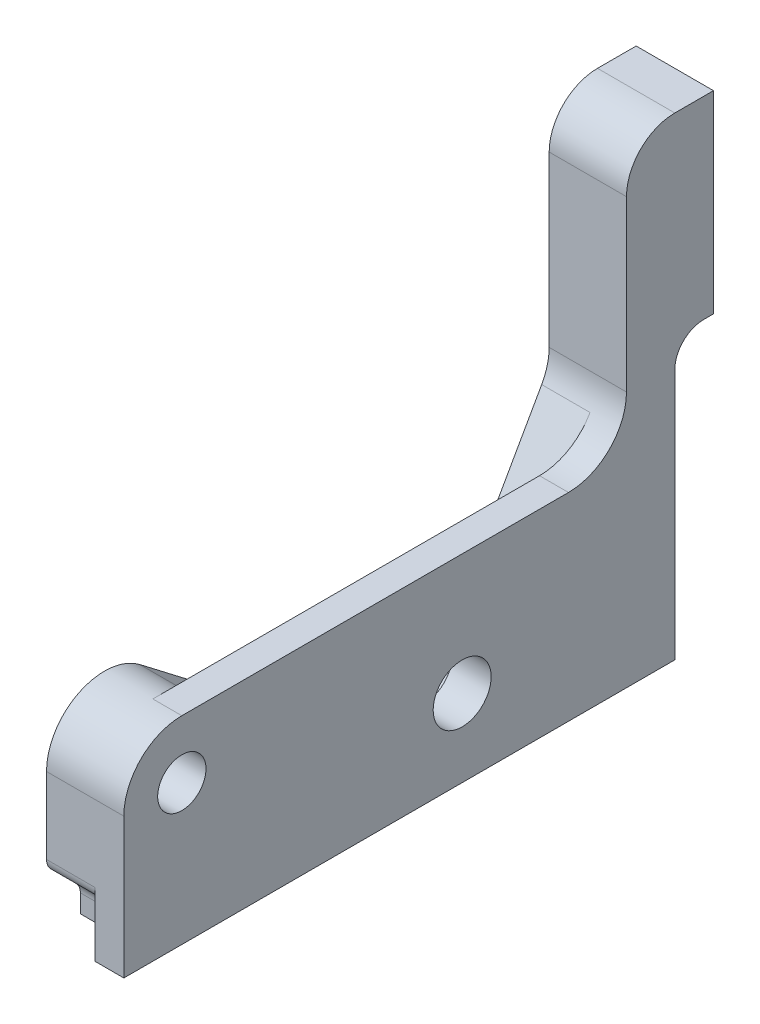
from build123d import *

# Parameters (mm, degrees)
SKETCH1_W                   = 61
SKETCH1_H                   = 49
SKETCH1_R                   = 2.5
SKETCH1_R_2                 = 3
BOSS_EXTRUDE1_DEPTH         = 8
CUT_EXTRUDE1_REACH          = 80.651
CUT_EXTRUDE2_REACH          = 80.651
SKETCH3_W                   = 4
SKETCH3_H                   = 29
FILLET1_R                   = 5
FILLET2_R                   = 3
TAP_DRILL_FOR_M3_TAP1_D     = 2.5
TAP_DRILL_FOR_M3_TAP1_DEPTH = 10
TAP_DRILL_FOR_M3_TAP1_TIP   = 0.751075774
TAP_DRILL_FOR_M3_TAP2_D     = 2.5
TAP_DRILL_FOR_M3_TAP2_DEPTH = 8
TAP_DRILL_FOR_M3_TAP2_TIP   = 0.751075774
CUT_EXTRUDE3_START          = -5
CUT_EXTRUDE3_DEPTH          = 5
SKETCH10_R                  = 3
BOSS_EXTRUDE2_DEPTH         = 1
FILLET3_R                   = 1.5


with BuildPart() as part:
    # Sketch1 → Boss-Extrude1 (new body)
    with BuildSketch(Plane(origin=(0, 0, 0), x_dir=(0, 0, -1), z_dir=(1, 0, 0))):
        with Locations((30.5, 24.5)):
            Rectangle(SKETCH1_W, SKETCH1_H)
        with Locations((6, 14.5)):
            Circle(SKETCH1_R, mode=Mode.SUBTRACT)
        with Locations((35, 8)):
            Circle(SKETCH1_R_2, mode=Mode.SUBTRACT)
    extrude(amount=BOSS_EXTRUDE1_DEPTH)

    # Sketch2 → Cut-Extrude1 (cut, up to next)
    with BuildSketch(Plane(origin=(8, 0, 0), x_dir=(0, 0, -1), z_dir=(1, 0, 0)), mode=Mode.PRIVATE) as cut_extrude1_sk1:
        with BuildLine():
            Line((6, 20.5), (46, 20.5))
            ThreePointArc((46, 20.5), (50.242640687, 22.257359313), (52, 26.5))
            Line((52, 26.5), (52, 50))
            Line((52, 50), (0, 50))
            Line((0, 50), (0, 14.5))
            ThreePointArc((0, 14.5), (1.757359313, 18.742640687), (6, 20.5))
        make_face()
    cut_extrude1_tool1 = extrude(cut_extrude1_sk1.sketch, amount=-CUT_EXTRUDE1_REACH, mode=Mode.PRIVATE) & part.part
    add(cut_extrude1_tool1.solids().sort_by_distance((8, 35.236501, -25.751612))[0], mode=Mode.SUBTRACT)

    # Sketch3 → Cut-Extrude2 (cut, up to next)
    with BuildSketch(Plane(origin=(8, 0, 0), x_dir=(0, 0, -1), z_dir=(1, 0, 0)), mode=Mode.PRIVATE) as cut_extrude2_sk1:
        with Locations((59, 14.5)):
            Rectangle(SKETCH3_W, SKETCH3_H)
    cut_extrude2_tool1 = extrude(cut_extrude2_sk1.sketch, amount=-CUT_EXTRUDE2_REACH, mode=Mode.PRIVATE) & part.part
    add(cut_extrude2_tool1.solids().sort_by_distance((8, 14.5, -59))[0], mode=Mode.SUBTRACT)

    # Fillet1
    fillet1_edges = [part.edges().sort_by_distance(p)[0] for p in [
        (4, 49, -52),
    ]]
    fillet(fillet1_edges, radius=FILLET1_R)

    # Fillet2
    fillet2_edges = [part.edges().sort_by_distance(p)[0] for p in [
        (4, 29, -57),
    ]]
    fillet(fillet2_edges, radius=FILLET2_R)

    # Tap Drill for M3 Tap1
    with Locations(Plane(origin=(0, 0, 0), x_dir=(-1, 0, 0), z_dir=(0, -1, 0))):
        with Locations((-4, 48), (-4, 12)):
            Hole(TAP_DRILL_FOR_M3_TAP1_D / 2, depth=TAP_DRILL_FOR_M3_TAP1_DEPTH)
            with Locations((0, 0, -(TAP_DRILL_FOR_M3_TAP1_DEPTH + TAP_DRILL_FOR_M3_TAP1_TIP / 2))):  # 118° drill point
                Cone(0, TAP_DRILL_FOR_M3_TAP1_D / 2, TAP_DRILL_FOR_M3_TAP1_TIP, mode=Mode.SUBTRACT)

    # Tap Drill for M3 Tap2
    with Locations(Plane(origin=(0, 0, -61), x_dir=(-1, 0, 0), z_dir=(0, 0, -1))):
        with Locations((-4, 44), (-4, 34)):
            Hole(TAP_DRILL_FOR_M3_TAP2_D / 2, depth=TAP_DRILL_FOR_M3_TAP2_DEPTH)
            with Locations((0, 0, -(TAP_DRILL_FOR_M3_TAP2_DEPTH + TAP_DRILL_FOR_M3_TAP2_TIP / 2))):  # 118° drill point
                Cone(0, TAP_DRILL_FOR_M3_TAP2_D / 2, TAP_DRILL_FOR_M3_TAP2_TIP, mode=Mode.SUBTRACT)

    # Sketch9 → Cut-Extrude3 (cut)
    with BuildSketch(Plane.ZY.offset(CUT_EXTRUDE3_START)):
        with BuildLine():
            Line((-51.227059389, 23.554180904), (-40.662647671, 4.808695979))
            ThreePointArc((-40.662647671, 4.808695979), (-36.300887291, 1.631507851), (-31.042531435, 2.843601785))
            Line((-31.042531435, 2.843601785), (-9.653047907, 19.259752199))
            ThreePointArc((-9.653047907, 19.259752199), (-3.346538811, 19.88137006), (0, 14.5))
            Line((0, 14.5), (0, 26.5))
            Line((0, 26.5), (-52, 26.5))
            ThreePointArc((-52, 26.5), (-51.803548756, 24.97723218), (-51.227059389, 23.554180904))
        make_face()
        Polygon((0, 6), (-3.5, 2.5), (-3.5, 0), (0, 0), align=None)
    extrude(amount=CUT_EXTRUDE3_DEPTH, mode=Mode.SUBTRACT)

    # Sketch10 → Boss-Extrude2 (add)
    with BuildSketch(Plane.ZY.offset(-5)):
        with BuildLine():
            Line((-42.701798604, 8.426964), (-40.662647671, 4.808695979))
            ThreePointArc((-40.662647671, 4.808695979), (-36.300887291, 1.631507851), (-31.042531435, 2.843601785))
            Line((-31.042531435, 2.843601785), (-27.747742168, 5.372309694))
            ThreePointArc((-27.747742168, 5.372309694), (-29.469968742, 5.299086519), (-30.123849342, 6.894036726))
            ThreePointArc((-30.123849342, 6.894036726), (-33.999317468, 12.898840115), (-39.919256736, 8.894937519))
            ThreePointArc((-39.919256736, 8.894937519), (-41.146254574, 7.684192991), (-42.701798604, 8.426964))
        make_face()
        with Locations((-35, 8)):
            Circle(SKETCH10_R, mode=Mode.SUBTRACT)
    extrude(amount=BOSS_EXTRUDE2_DEPTH)

    # Fillet3
    fillet3_edges = [part.edges().sort_by_distance(p)[0] for p in [
        (2.5, 6, 0),
        (2.5, 2.5, -3.5),
    ]]
    fillet(fillet3_edges, radius=FILLET3_R)


solid = part.part
